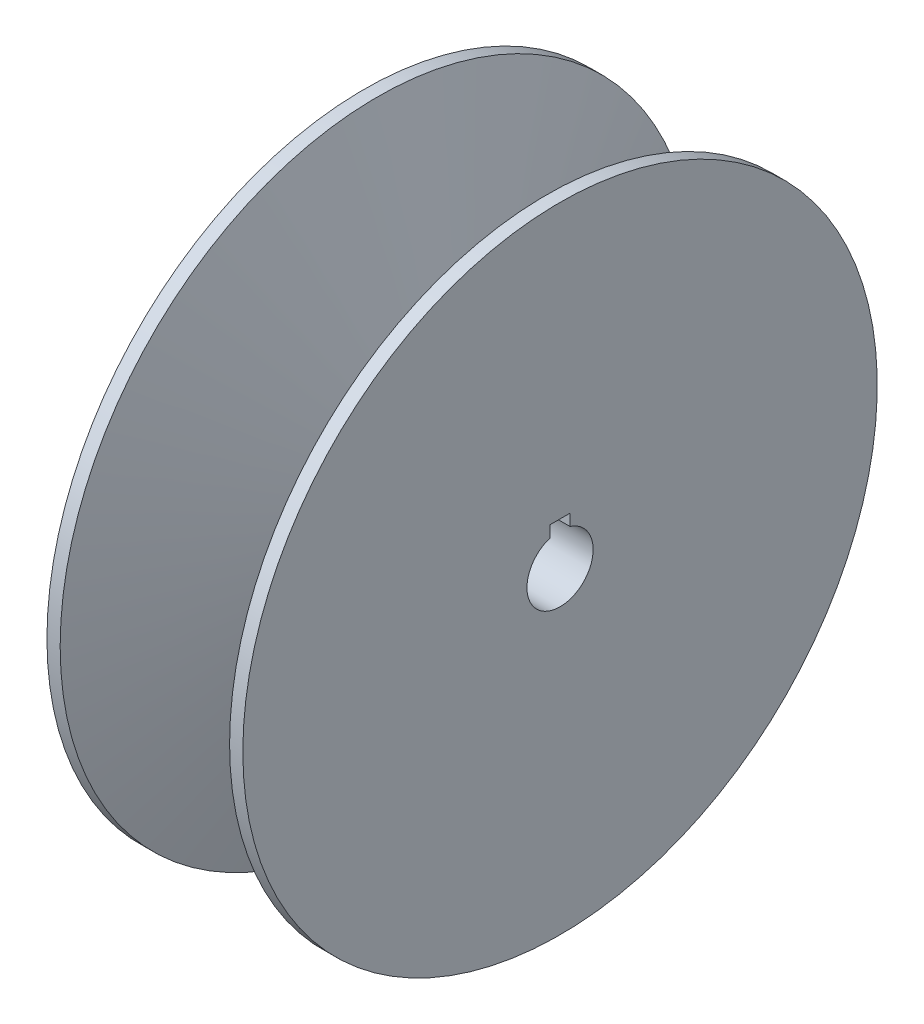
from build123d import *

# Parameters (mm, degrees)
SKETCH1_W               = 3.175
SKETCH1_H               = 69.74205
CUT_EXTRUDE1_DEPTH      = 25.146
CUT_EXTRUDE1_DEPTH_BACK = 108.204


with BuildPart() as part:
    # Sketch1 → Revolve1 (revolve)
    with BuildSketch(Plane.XY, mode=Mode.PRIVATE) as revolve1_sk:
        Polygon((13.238453462, 31.037681507), (0, 76.09205), (0, 6.35), (22.013333333, 6.35), (40.64, 6.35), (40.64, 76.09205), (27.401546538, 31.037681507), align=None)
        with Locations((-1.5875, 41.221025)):
            Rectangle(SKETCH1_W, SKETCH1_H)
        with Locations((42.2275, 41.221025)):
            Rectangle(SKETCH1_W, SKETCH1_H)
    revolve(revolve1_sk.sketch.rotate(Axis((0, 0, 0), (1, 0, 0)), 90), axis=Axis((0, 0, 0), (1, 0, 0)))

    # Sketch2 → Cut-Extrude1 (cut, two sides: drawn at the far end of the back side and taken through both)
    with BuildSketch(Plane(origin=(43.815, 0, 0), x_dir=(0, 0, -1), z_dir=(1, 0, 0)).offset(-CUT_EXTRUDE1_DEPTH_BACK)):
        with BuildLine():
            Line((2.38125, 7.571892411), (2.38125, 5.886607549))
            ThreePointArc((2.38125, 5.886607549), (5.265141855, 3.549757914), (6.35, 0))
            ThreePointArc((6.35, 0), (-3.549757914, -5.265141855), (-2.38125, 5.886607549))
            Line((-2.38125, 5.886607549), (-2.38125, 7.571892411))
            ThreePointArc((-2.38125, 7.571892411), (-4.695888328, -6.399417088), (7.9375, 0))
            ThreePointArc((7.9375, 0), (6.399417088, 4.695888328), (2.38125, 7.571892411))
        make_face()
        with BuildLine():
            ThreePointArc((-2.38125, 5.886607549), (0, 6.35), (2.38125, 5.886607549))
            Line((2.38125, 5.886607549), (2.38125, 7.571892411))
            ThreePointArc((2.38125, 7.571892411), (0, 7.9375), (-2.38125, 7.571892411))
            Line((-2.38125, 7.571892411), (-2.38125, 5.886607549))
        make_face()
        with BuildLine():
            ThreePointArc((-2.38125, 7.571892411), (0, 7.9375), (2.38125, 7.571892411))
            Line((2.38125, 7.571892411), (2.38125, 10.31875))
            Line((2.38125, 10.31875), (-2.38125, 10.31875))
            Line((-2.38125, 10.31875), (-2.38125, 7.571892411))
        make_face()
        with BuildLine():
            Line((-2.38125, 5.55625), (2.38125, 5.55625))
            Line((2.38125, 5.55625), (2.38125, 5.886607549))
            ThreePointArc((2.38125, 5.886607549), (0, 6.35), (-2.38125, 5.886607549))
            Line((-2.38125, 5.886607549), (-2.38125, 5.55625))
        make_face()
    extrude(amount=CUT_EXTRUDE1_DEPTH + CUT_EXTRUDE1_DEPTH_BACK, mode=Mode.SUBTRACT)


solid = part.part
